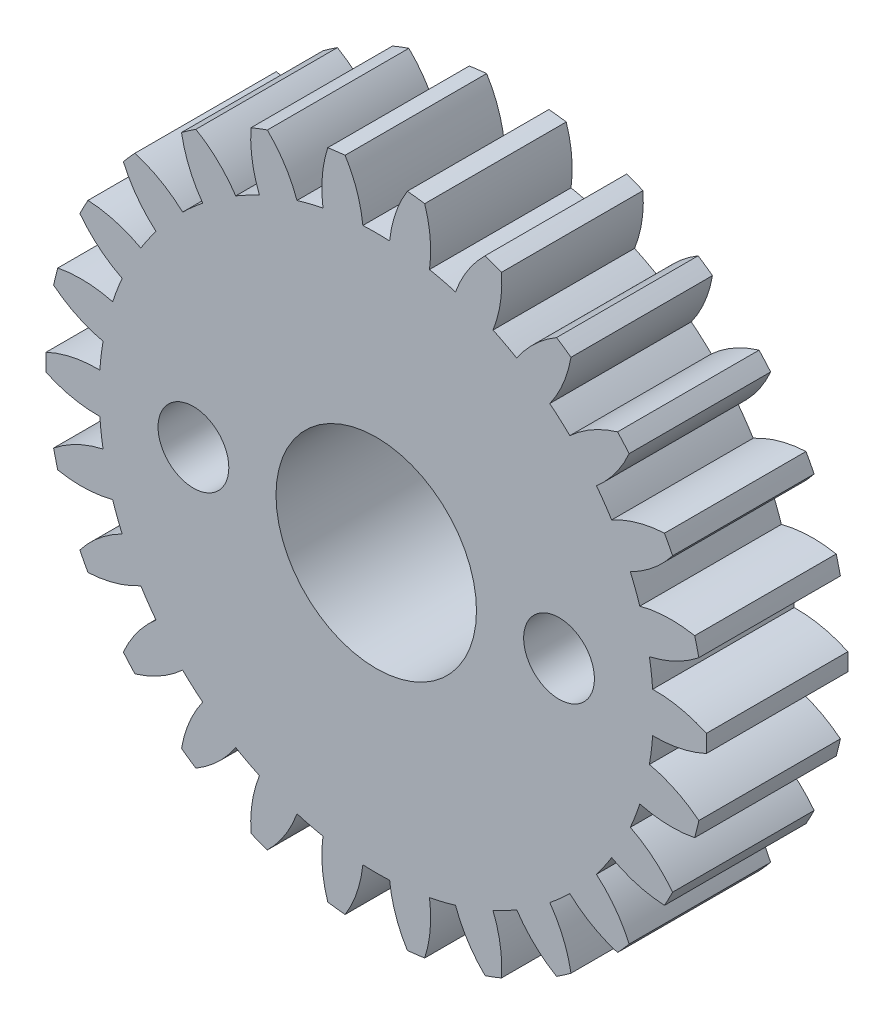
from build123d import *

# Parameters (mm, degrees)
CROQUIS1_R              = 1.5
CROQUIS1_R_2            = 4.25
SALIENTE_EXTRUIR1_DEPTH = 6


with BuildPart() as part:
    # Croquis1 → Saliente-Extruir1 (new body)
    with BuildSketch(Plane.XY):
        with BuildLine():
            ThreePointArc((-26.416202484, 10.907392984), (-26.088677353, 9.783179838), (-25.517912196, 8.76075378))
            ThreePointArc((-25.517912196, 8.76075378), (-25.952107835, 8.394437965), (-26.368089296, 8.007562594))
            ThreePointArc((-26.368089296, 8.007562594), (-27.31426258, 8.697406073), (-28.390800155, 9.158052097))
            ThreePointArc((-28.390800155, 9.158052097), (-28.640230198, 8.883902401), (-28.882315565, 8.603245889))
            ThreePointArc((-28.882315565, 8.603245889), (-28.295265904, 7.590082227), (-27.496403574, 6.733959055))
            ThreePointArc((-27.496403574, 6.733959055), (-27.830317164, 6.274377895), (-28.141625623, 5.799193538))
            ThreePointArc((-28.141625623, 5.799193538), (-29.225395181, 6.242557332), (-30.38089034, 6.432185515))
            ThreePointArc((-30.38089034, 6.432185515), (-30.557464083, 6.106309594), (-30.72534939, 5.77587363))
            ThreePointArc((-30.72534939, 5.77587363), (-29.91289239, 4.932640843), (-28.932359861, 4.292575323))
            ThreePointArc((-28.932359861, 4.292575323), (-29.146585559, 3.766438003), (-29.3351289, 3.23056065))
            ThreePointArc((-29.3351289, 3.23056065), (-30.493509985, 3.401678066), (-31.660809549, 3.309267907))
            ThreePointArc((-31.660809549, 3.309267907), (-31.754265168, 2.950604485), (-31.83819353, 2.589592806))
            ThreePointArc((-31.83819353, 2.589592806), (-30.84754624, 1.965296518), (-29.742328499, 1.578486932))
            ThreePointArc((-29.742328499, 1.578486932), (-29.824416286, 1.016370642), (-29.879237055, 0.450943536))
            ThreePointArc((-29.879237055, 0.450943536), (-31.044908769, 0.339869851), (-32.156173531, -0.029208107))
            ThreePointArc((-32.156173531, -0.029208107), (-32.161079724, -0.399814815), (-32.156173531, -0.770421523))
            ThreePointArc((-32.156173531, -0.770421523), (-31.044908769, -1.139499481), (-29.879237055, -1.250573165))
            ThreePointArc((-29.879237055, -1.250573165), (-29.824416286, -1.816000271), (-29.742328499, -2.378116562))
            ThreePointArc((-29.742328499, -2.378116562), (-30.84754624, -2.764926147), (-31.83819353, -3.389222436))
            ThreePointArc((-31.83819353, -3.389222436), (-31.754265168, -3.750234115), (-31.660809549, -4.108897536))
            ThreePointArc((-31.660809549, -4.108897536), (-30.493509985, -4.201307695), (-29.3351289, -4.03019028))
            ThreePointArc((-29.3351289, -4.03019028), (-29.146585559, -4.566067633), (-28.932359861, -5.092204952))
            ThreePointArc((-28.932359861, -5.092204952), (-29.91289239, -5.732270472), (-30.72534939, -6.575503259))
            ThreePointArc((-30.72534939, -6.575503259), (-30.557464083, -6.905939223), (-30.38089034, -7.231815144))
            ThreePointArc((-30.38089034, -7.231815144), (-29.225395181, -7.042186962), (-28.141625623, -6.598823168))
            ThreePointArc((-28.141625623, -6.598823168), (-27.830317164, -7.074007524), (-27.496403574, -7.533588684))
            ThreePointArc((-27.496403574, -7.533588684), (-28.295265904, -8.389711857), (-28.882315565, -9.402875518))
            ThreePointArc((-28.882315565, -9.402875518), (-28.640230198, -9.68353203), (-28.390800155, -9.957681727))
            ThreePointArc((-28.390800155, -9.957681727), (-27.31426258, -9.497035703), (-26.368089296, -8.807192223))
            ThreePointArc((-26.368089296, -8.807192223), (-25.952107835, -9.194067595), (-25.517912196, -9.560383409))
            ThreePointArc((-25.517912196, -9.560383409), (-26.088677353, -10.582809468), (-26.416202484, -11.707022614))
            ThreePointArc((-26.416202484, -11.707022614), (-26.113986178, -11.921588937), (-25.806195802, -12.128079825))
            ThreePointArc((-25.806195802, -12.128079825), (-24.871180261, -11.423187033), (-24.117591404, -10.526955063))
            ThreePointArc((-24.117591404, -10.526955063), (-23.621112272, -10.80303766), (-23.111868457, -11.054799185))
            ThreePointArc((-23.111868457, -11.054799185), (-23.421365644, -12.184108443), (-23.470331674, -13.354035893))
            ThreePointArc((-23.470331674, -13.354035893), (-23.125548142, -13.490042212), (-22.777285091, -13.616873792))
            ThreePointArc((-22.777285091, -13.616873792), (-22.03813129, -12.708700038), (-21.520922704, -11.658165322))
            ThreePointArc((-21.520922704, -11.658165322), (-20.972799464, -11.807410228), (-20.418102871, -11.929985998))
            ThreePointArc((-20.418102871, -11.929985998), (-20.448345238, -13.100547107), (-20.215906439, -14.248196929))
            ThreePointArc((-20.215906439, -14.248196929), (-19.848593247, -14.297739052), (-19.480097304, -14.337540333))
            ThreePointArc((-19.480097304, -14.337540333), (-18.979762174, -13.278865375), (-18.728992143, -12.135081172))
            ThreePointArc((-18.728992143, -12.135081172), (-18.161079724, -12.148814815), (-17.593167305, -12.135081172))
            ThreePointArc((-17.593167305, -12.135081172), (-17.342397274, -13.278865375), (-16.842062144, -14.337540333))
            ThreePointArc((-16.842062144, -14.337540333), (-16.4735662, -14.297739052), (-16.106253009, -14.248196929))
            ThreePointArc((-16.106253009, -14.248196929), (-15.87381421, -13.100547107), (-15.904056576, -11.929985998))
            ThreePointArc((-15.904056576, -11.929985998), (-15.349359984, -11.807410228), (-14.801236743, -11.658165322))
            ThreePointArc((-14.801236743, -11.658165322), (-14.284028158, -12.708700038), (-13.544874357, -13.616873792))
            ThreePointArc((-13.544874357, -13.616873792), (-13.196611305, -13.490042212), (-12.851827774, -13.354035893))
            ThreePointArc((-12.851827774, -13.354035893), (-12.900793803, -12.184108443), (-13.210290991, -11.054799185))
            ThreePointArc((-13.210290991, -11.054799185), (-12.701047175, -10.80303766), (-12.204568044, -10.526955063))
            ThreePointArc((-12.204568044, -10.526955063), (-11.450979186, -11.423187033), (-10.515963646, -12.128079825))
            ThreePointArc((-10.515963646, -12.128079825), (-10.20817327, -11.921588937), (-9.905956964, -11.707022614))
            ThreePointArc((-9.905956964, -11.707022614), (-10.233482094, -10.582809468), (-10.804247251, -9.560383409))
            ThreePointArc((-10.804247251, -9.560383409), (-10.370051612, -9.194067595), (-9.954070152, -8.807192223))
            ThreePointArc((-9.954070152, -8.807192223), (-9.007896868, -9.497035703), (-7.931359293, -9.957681727))
            ThreePointArc((-7.931359293, -9.957681727), (-7.681929249, -9.68353203), (-7.439843882, -9.402875518))
            ThreePointArc((-7.439843882, -9.402875518), (-8.026893544, -8.389711857), (-8.825755874, -7.533588684))
            ThreePointArc((-8.825755874, -7.533588684), (-8.491842283, -7.074007524), (-8.180533825, -6.598823168))
            ThreePointArc((-8.180533825, -6.598823168), (-7.096764266, -7.042186962), (-5.941269108, -7.231815144))
            ThreePointArc((-5.941269108, -7.231815144), (-5.764695365, -6.905939223), (-5.596810058, -6.575503259))
            ThreePointArc((-5.596810058, -6.575503259), (-6.409267058, -5.732270472), (-7.389799586, -5.092204952))
            ThreePointArc((-7.389799586, -5.092204952), (-7.175573888, -4.566067633), (-6.987030548, -4.03019028))
            ThreePointArc((-6.987030548, -4.03019028), (-5.828649462, -4.201307695), (-4.661349898, -4.108897536))
            ThreePointArc((-4.661349898, -4.108897536), (-4.56789428, -3.750234115), (-4.483965917, -3.389222436))
            ThreePointArc((-4.483965917, -3.389222436), (-5.474613208, -2.764926147), (-6.579830948, -2.378116562))
            ThreePointArc((-6.579830948, -2.378116562), (-6.497743162, -1.816000271), (-6.442922393, -1.250573165))
            ThreePointArc((-6.442922393, -1.250573165), (-5.277250678, -1.139499481), (-4.165985917, -0.770421523))
            ThreePointArc((-4.165985917, -0.770421523), (-4.161079724, -0.399814815), (-4.165985917, -0.029208107))
            ThreePointArc((-4.165985917, -0.029208107), (-5.277250678, 0.339869851), (-6.442922393, 0.450943536))
            ThreePointArc((-6.442922393, 0.450943536), (-6.497743162, 1.016370642), (-6.579830948, 1.578486932))
            ThreePointArc((-6.579830948, 1.578486932), (-5.474613208, 1.965296518), (-4.483965917, 2.589592806))
            ThreePointArc((-4.483965917, 2.589592806), (-4.56789428, 2.950604485), (-4.661349898, 3.309267907))
            ThreePointArc((-4.661349898, 3.309267907), (-5.828649462, 3.401678066), (-6.987030548, 3.23056065))
            ThreePointArc((-6.987030548, 3.23056065), (-7.175573888, 3.766438003), (-7.389799586, 4.292575323))
            ThreePointArc((-7.389799586, 4.292575323), (-6.409267058, 4.932640843), (-5.596810058, 5.77587363))
            ThreePointArc((-5.596810058, 5.77587363), (-5.764695365, 6.106309594), (-5.941269108, 6.432185515))
            ThreePointArc((-5.941269108, 6.432185515), (-7.096764266, 6.242557332), (-8.180533825, 5.799193538))
            ThreePointArc((-8.180533825, 5.799193538), (-8.491842283, 6.274377895), (-8.825755874, 6.733959055))
            ThreePointArc((-8.825755874, 6.733959055), (-8.026893544, 7.590082227), (-7.439843882, 8.603245889))
            ThreePointArc((-7.439843882, 8.603245889), (-7.681929249, 8.883902401), (-7.931359293, 9.158052097))
            ThreePointArc((-7.931359293, 9.158052097), (-9.007896868, 8.697406073), (-9.954070152, 8.007562594))
            ThreePointArc((-9.954070152, 8.007562594), (-10.370051612, 8.394437965), (-10.804247251, 8.76075378))
            ThreePointArc((-10.804247251, 8.76075378), (-10.233482094, 9.783179838), (-9.905956964, 10.907392984))
            ThreePointArc((-9.905956964, 10.907392984), (-10.20817327, 11.121959308), (-10.515963646, 11.328450196))
            ThreePointArc((-10.515963646, 11.328450196), (-11.450979186, 10.623557403), (-12.204568044, 9.727325433))
            ThreePointArc((-12.204568044, 9.727325433), (-12.701047175, 10.003408031), (-13.210290991, 10.255169555))
            ThreePointArc((-13.210290991, 10.255169555), (-12.900793803, 11.384478813), (-12.851827774, 12.554406263))
            ThreePointArc((-12.851827774, 12.554406263), (-13.196611305, 12.690412583), (-13.544874357, 12.817244162))
            ThreePointArc((-13.544874357, 12.817244162), (-14.284028158, 11.909070408), (-14.801236743, 10.858535693))
            ThreePointArc((-14.801236743, 10.858535693), (-15.349359984, 11.007780598), (-15.904056576, 11.130356368))
            ThreePointArc((-15.904056576, 11.130356368), (-15.87381421, 12.300917477), (-16.106253009, 13.448567299))
            ThreePointArc((-16.106253009, 13.448567299), (-16.4735662, 13.498109423), (-16.842062144, 13.537910704))
            ThreePointArc((-16.842062144, 13.537910704), (-17.342397274, 12.479235745), (-17.593167305, 11.335451543))
            ThreePointArc((-17.593167305, 11.335451543), (-18.161079724, 11.349185185), (-18.728992143, 11.335451543))
            ThreePointArc((-18.728992143, 11.335451543), (-18.979762174, 12.479235745), (-19.480097304, 13.537910704))
            ThreePointArc((-19.480097304, 13.537910704), (-19.848593247, 13.498109423), (-20.215906439, 13.448567299))
            ThreePointArc((-20.215906439, 13.448567299), (-20.448345238, 12.300917477), (-20.418102871, 11.130356368))
            ThreePointArc((-20.418102871, 11.130356368), (-20.972799464, 11.007780598), (-21.520922704, 10.858535693))
            ThreePointArc((-21.520922704, 10.858535693), (-22.03813129, 11.909070408), (-22.777285091, 12.817244162))
            ThreePointArc((-22.777285091, 12.817244162), (-23.125548142, 12.690412583), (-23.470331674, 12.554406263))
            ThreePointArc((-23.470331674, 12.554406263), (-23.421365644, 11.384478813), (-23.111868457, 10.255169555))
            ThreePointArc((-23.111868457, 10.255169555), (-23.621112272, 10.003408031), (-24.117591404, 9.727325433))
            ThreePointArc((-24.117591404, 9.727325433), (-24.871180261, 10.623557403), (-25.806195802, 11.328450196))
            ThreePointArc((-25.806195802, 11.328450196), (-26.113986178, 11.121959308), (-26.416202484, 10.907392984))
        make_face()
        with Locations((-25.911079724, -0.399814815)):
            Circle(CROQUIS1_R, mode=Mode.SUBTRACT)
        with Locations((-18.161079724, -0.399814815)):
            Circle(CROQUIS1_R_2, mode=Mode.SUBTRACT)
        with Locations((-10.411079724, -0.399814815)):
            Circle(CROQUIS1_R, mode=Mode.SUBTRACT)
    extrude(amount=SALIENTE_EXTRUIR1_DEPTH)


solid = part.part
